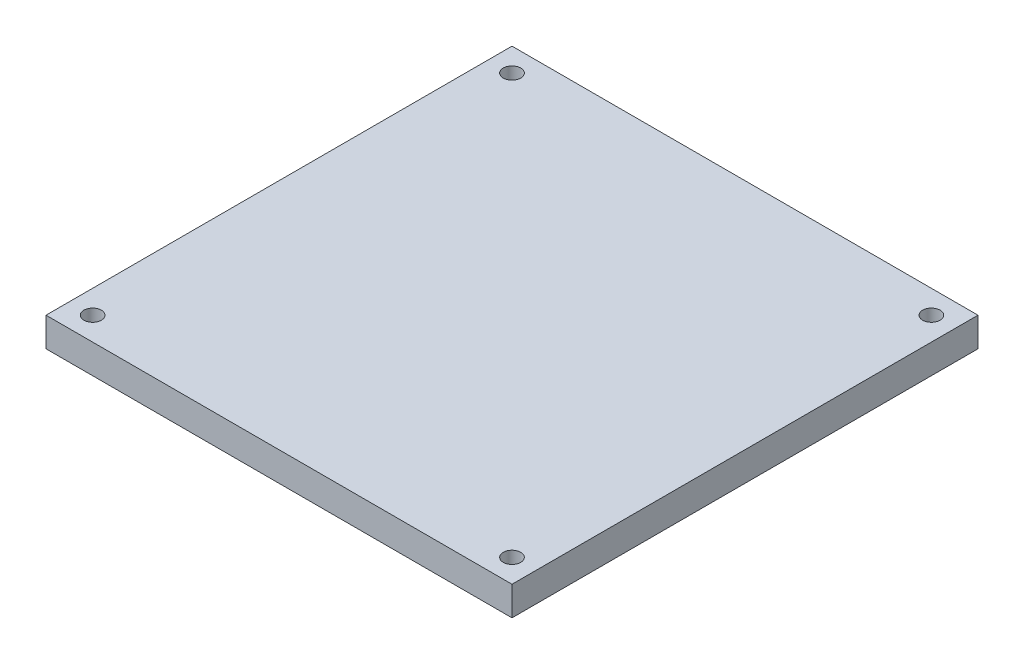
from build123d import *

# Parameters (mm, degrees)
ESQUISSE1_W      = 80
ESQUISSE1_H      = 80
ESQUISSE1_R      = 1.5
EXTRUSION1_DEPTH = 5


with BuildPart() as part:
    # Esquisse1 → Extrusion1 (new body)
    with BuildSketch(Plane(origin=(0, 0, 0), x_dir=(1, 0, 0), z_dir=(0, 1, 0))):
        Rectangle(ESQUISSE1_W, ESQUISSE1_H)
        with Locations(Location((-36, 36, 0), (0, 0, 270))):
            Circle(ESQUISSE1_R, mode=Mode.SUBTRACT)
        with Locations(Location((36, 36, 0), (0, 0, 90))):
            Circle(ESQUISSE1_R, mode=Mode.SUBTRACT)
        with Locations(Location((-36, -36, 0), (0, 0, 90))):
            Circle(ESQUISSE1_R, mode=Mode.SUBTRACT)
        with Locations(Location((36, -36, 0), (0, 0, 270))):
            Circle(ESQUISSE1_R, mode=Mode.SUBTRACT)
    extrude(amount=EXTRUSION1_DEPTH)


solid = part.part
